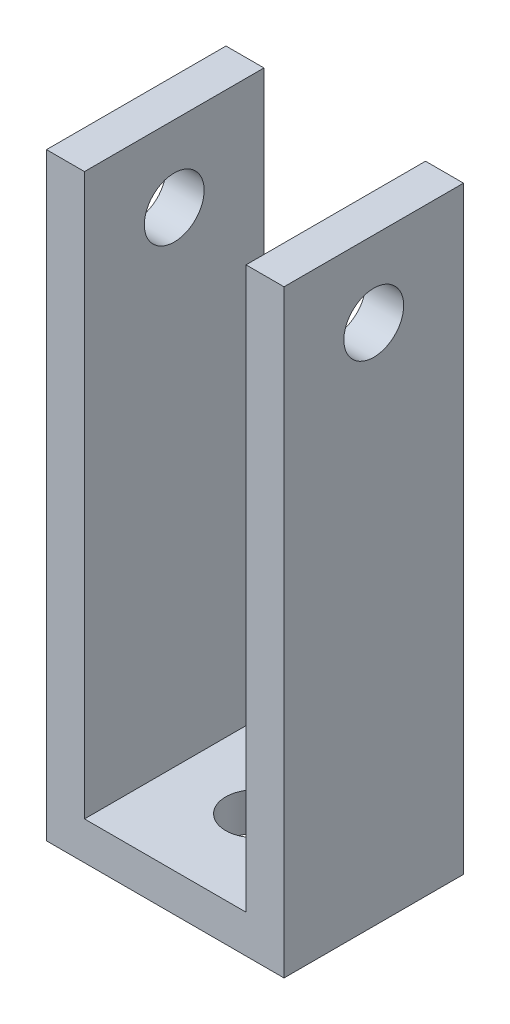
from build123d import *

# Parameters (mm, degrees)
SALIENTE_EXTRUIR1_DEPTH = 15
CROQUIS2_R              = 5
CORTAR_EXTRUIR1_DEPTH   = 60
CROQUIS3_R              = 4.9
CORTAR_EXTRUIR2_DEPTH   = 60


with BuildPart() as part:
    # Croquis1 → Saliente-Extruir1 (new, symmetric)
    with BuildSketch(Plane.XY):
        Polygon((-13.5, -81), (-13.5, 12.7), (-19.85, 12.7), (-19.85, -87.35), (0, -87.35), (0, -81), align=None)
        Polygon((13.5, -81), (0, -81), (0, -87.35), (19.85, -87.35), (19.85, 12.7), (13.5, 12.7), align=None)
    extrude(amount=SALIENTE_EXTRUIR1_DEPTH, both=True)

    # Croquis2 → Cortar-Extruir1 (cut)
    with BuildSketch(Plane.ZY.offset(19.85)):
        with Locations(Location((0, 0, 0), (0, 0, 270))):
            Circle(CROQUIS2_R)
    extrude(amount=-CORTAR_EXTRUIR1_DEPTH, mode=Mode.SUBTRACT)

    # Croquis3 → Cortar-Extruir2 (cut)
    with BuildSketch(Plane.XZ.offset(87.35)):
        Circle(CROQUIS3_R)
    extrude(amount=-CORTAR_EXTRUIR2_DEPTH, mode=Mode.SUBTRACT)


solid = part.part
